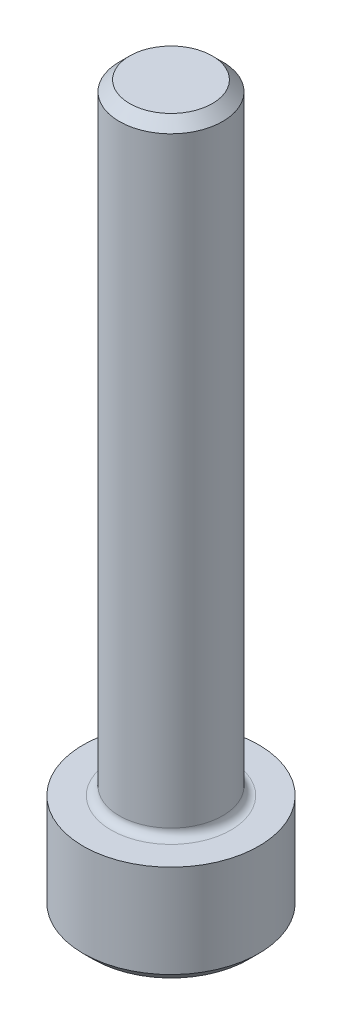
from build123d import *

# Parameters (mm, degrees)
SKETCH2_R           = 2.5
BOSS_EXTRUDE1_DEPTH = 30
SKETCH3_R           = 4.25
BOSS_EXTRUDE2_DEPTH = 5
FILLET1_R           = 0.4
CHAMFER1_SIZE       = 0.5
CUT_EXTRUDE1_DEPTH  = 2.5


with BuildPart() as part:
    # Sketch2 → Boss-Extrude1 (new body)
    with BuildSketch(Plane(origin=(0, 0, 0), x_dir=(1, 0, 0), z_dir=(0, 1, 0))):
        with Locations(Location((0, 0, 0), (0, 0, 270))):
            Circle(SKETCH2_R)
    extrude(amount=BOSS_EXTRUDE1_DEPTH)

    # Sketch3 → Boss-Extrude2 (add)
    with BuildSketch(Plane(origin=(0, 0, 0), x_dir=(1, 0, 0), z_dir=(0, 1, 0))):
        with Locations(Location((0, 0, 0), (0, 0, 270))):
            Circle(SKETCH3_R)
    extrude(amount=-BOSS_EXTRUDE2_DEPTH)

    # Fillet1
    fillet1_edges = [part.edges().sort_by_distance(p)[0] for p in [
        (0, 0, -2.5),
    ]]
    fillet(fillet1_edges, radius=FILLET1_R)

    # Chamfer1
    chamfer1_edges = [part.edges().sort_by_distance(p)[0] for p in [
        (0, 30, -2.5),
        (0, -5, -4.25),
    ]]
    chamfer(chamfer1_edges, length=CHAMFER1_SIZE)

    # Sketch4 → Cut-Extrude1 (cut)
    with BuildSketch(Plane.XZ.offset(5)):
        Polygon((0, 2.309401077), (-2, 1.154700538), (-2, -1.154700538), (0, -2.309401077), (2, -1.154700538), (2, 1.154700538), align=None)
    extrude(amount=-CUT_EXTRUDE1_DEPTH, mode=Mode.SUBTRACT)


solid = part.part
